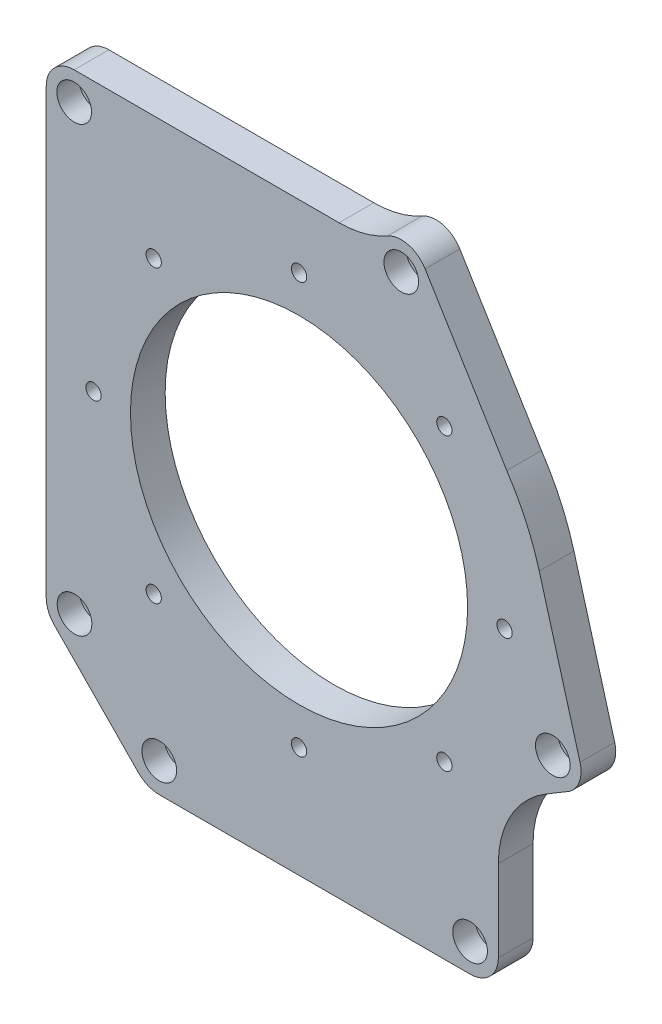
from build123d import *

# Parameters (mm, degrees)
BOSS_EXTRUDE1_DEPTH             = 18.0086
FILLET2_R                       = 50.8
CBORE_FOR_M10_SHCS7_D           = 10.5
CBORE_FOR_M10_SHCS7_CBORE_D     = 18
CBORE_FOR_M10_SHCS7_CBORE_DEPTH = 11.5
F_10_0MM_DOWEL_HOLE3_D          = 10
F_10_0MM_DOWEL_HOLE3_DEPTH      = 10
F_10_0MM_DOWEL_HOLE3_TIP        = 3.004303095
SKETCH79_R                      = 87.5
CUT_EXTRUDE3_DEPTH              = 221.734456483
F_3_8_16_TAPPED_HOLE3_D         = 7.9375


with BuildPart() as part:
    # Sketch1 → Boss-Extrude1 (new body)
    with BuildSketch(Plane.XY):
        with BuildLine():
            Line((103.452131625, -149.547952394), (103.452131625, -78.357146561))
            Line((103.452131625, -78.357146561), (140.546655396, -56.14120472))
            ThreePointArc((140.546655396, -56.14120472), (145.621790531, -49.117452101), (145.848381407, -40.454960885))
            Line((145.848381407, -40.454960885), (124.68673049, 34.942398048))
            ThreePointArc((124.68673049, 34.942398048), (117.704280966, 53.953895974), (107.843572082, 71.644517079))
            Line((107.843572082, 71.644517079), (65.450124697, 141.120289253))
            ThreePointArc((65.450124697, 141.120289253), (56.413981198, 147.677287258), (45.396832362, 145.869375848))
            Line((45.396832362, 145.869375848), (35.245747779, 139.53567106))
            Line((35.245747779, 139.53567106), (-116.713297339, 139.53567106))
            ThreePointArc((-116.713297339, 139.53567106), (-126.966345666, 135.288719387), (-131.213297339, 125.03567106))
            Line((-131.213297339, 125.03567106), (-131.213297339, -104.964264785))
            ThreePointArc((-131.213297339, -104.964264785), (-130.122475458, -110.515726026), (-127.012211231, -115.241704308))
            Line((-127.012211231, -115.241704308), (-83.421786595, -159.651825232))
            ThreePointArc((-83.421786595, -159.651825232), (-78.439848506, -163.031227751), (-72.538298924, -164.219411681))
            Line((-72.538298924, -164.219411681), (88.682165599, -164.219411681))
            ThreePointArc((88.682165599, -164.219411681), (99.120094961, -159.957126401), (103.452131625, -149.547952394))
        make_face()
    extrude(amount=BOSS_EXTRUDE1_DEPTH)

    # Fillet2
    fillet2_edges = [part.edges().sort_by_distance(p)[0] for p in [
        (35.245747779, 139.53567106, 9.0043),
        (103.452131625, -78.357146561, 9.0043),
    ]]
    fillet(fillet2_edges, radius=FILLET2_R)

    # CBORE for M10 SHCS7 (through all)
    with Locations(Plane.XY.offset(18.0086)):
        with Locations((-116.713297339, 125.03567106), (-116.541509562, -104.964264785), (-72.538298924, -148.969218673), (53.072470058, 133.567563544), (131.722431635, -44.419667636), (88.780343848, -149.547952394)):
            CounterBoreHole(CBORE_FOR_M10_SHCS7_D / 2, CBORE_FOR_M10_SHCS7_CBORE_D / 2, CBORE_FOR_M10_SHCS7_CBORE_DEPTH)

    # Ø10.0mm Dowel Hole3
    with Locations(Plane(origin=(0, 0, 0), x_dir=(-1, 0, 0), z_dir=(0, 0, -1))):
        with Locations((76.55340813, 103.753913834), (-59.102558089, -114.980445858)):
            Hole(F_10_0MM_DOWEL_HOLE3_D / 2, depth=F_10_0MM_DOWEL_HOLE3_DEPTH)
            with Locations((0, 0, -(F_10_0MM_DOWEL_HOLE3_DEPTH + F_10_0MM_DOWEL_HOLE3_TIP / 2))):  # 118° drill point
                Cone(0, F_10_0MM_DOWEL_HOLE3_D / 2, F_10_0MM_DOWEL_HOLE3_TIP, mode=Mode.SUBTRACT)

    # Sketch79 → Cut-Extrude3 (cut, through all)
    with BuildSketch(Plane.XY.offset(18.0086)):
        Circle(SKETCH79_R)
    extrude(amount=-CUT_EXTRUDE3_DEPTH, mode=Mode.SUBTRACT)

    # 3/8-16 Tapped Hole3 (through all)
    with Locations(Plane.XY.offset(18.0086)):
        with Locations((75.434151417, -75.434151417), (75.434151417, 75.434151417), (-75.434151417, 75.434151417), (-75.434151417, -75.434151417), (106.68, 0), (0, -106.68), (0, 106.68), (-106.68, 0)):
            Hole(F_3_8_16_TAPPED_HOLE3_D / 2)


solid = part.part
